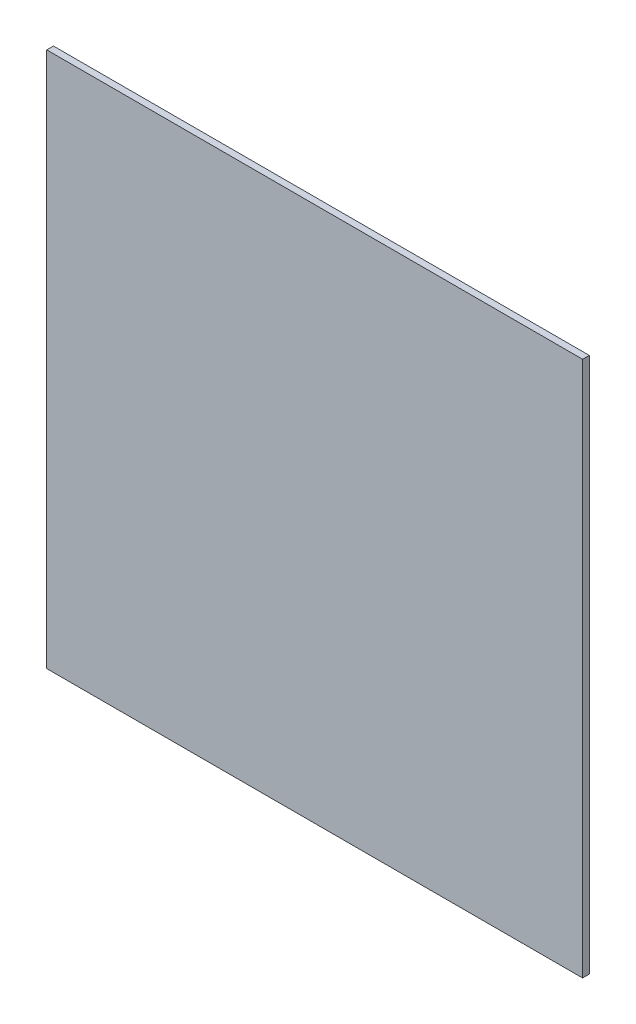
from build123d import *

# Parameters (mm, degrees)
SKETCH1_W           = 127
SKETCH1_H           = 127
BOSS_EXTRUDE1_DEPTH = 1.5875


with BuildPart() as part:
    # Sketch1 → Boss-Extrude1 (new body)
    with BuildSketch(Plane.XY):
        with Locations((367.411, -88.010866002)):
            Rectangle(SKETCH1_W, SKETCH1_H)
    extrude(amount=-BOSS_EXTRUDE1_DEPTH)


solid = part.part
